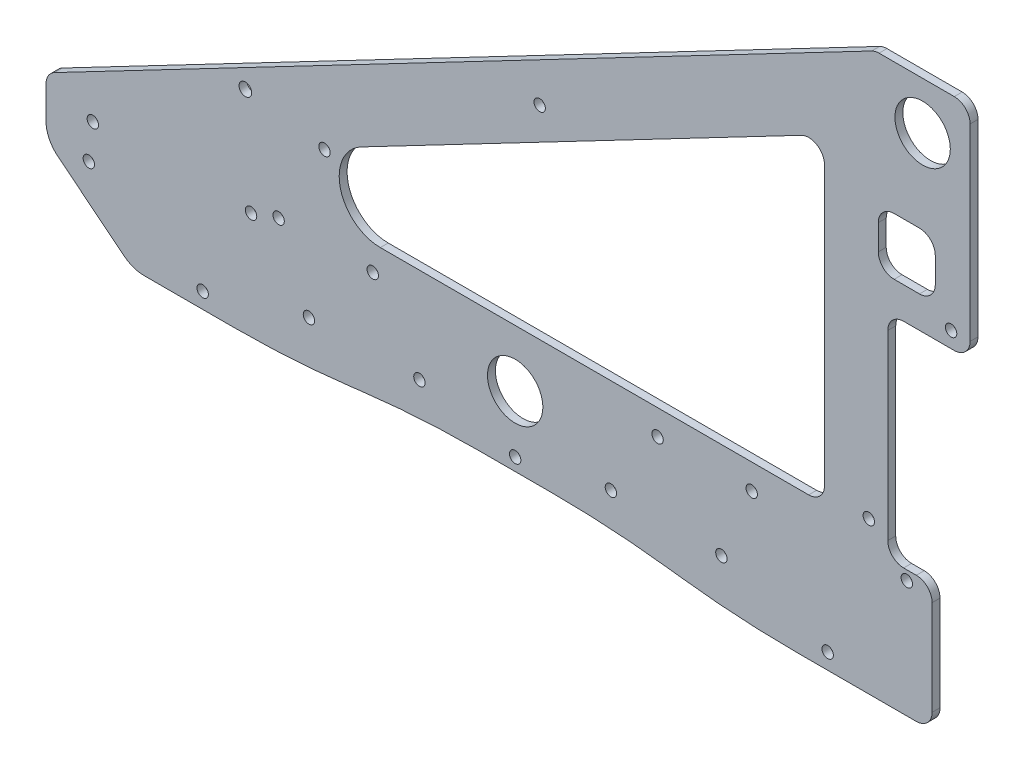
from build123d import *

# Parameters (mm, degrees)
SKETCH1_W            = 355.6
SKETCH1_H            = 50.8
SKETCH1_R            = 2.286
SKETCH1_R_2          = 11.1125
BOTTOM_2_DEPTH       = 3.175
CUT_EXTRUDE1_DEPTH   = 360.224276219
FILLET1_R            = 12.7
BOTTOM_CUTOUT_DEPTH  = 360.224276219
SKETCH5_R            = 11.1125
UPPER_TRIANGLE_DEPTH = 3.175
SKETCH6_R            = 2.286
GEARBOX_HOLES_DEPTH  = 421.704153444
SKETCH7_R            = 2.286
CUT_EXTRUDE4_DEPTH   = 421.704153444
SKETCH8_R            = 2.286
SKETCH8_W            = 22.86
SKETCH8_H            = 22.86
SKETCH8_W_2          = 33.02
SKETCH8_H_2          = 85.725
CUT_EXTRUDE5_DEPTH   = 421.704153444
SKETCH9_R            = 2.286
CUT_EXTRUDE6_DEPTH   = 421.704153444
FILLET2_R            = 6.35
FILLET3_R            = 6.35
SKETCH16_R           = 2.286
CUT_EXTRUDE12_DEPTH  = 421.704153444
FILLET11_R           = 16.51
SKETCH19_R           = 2.54
SKETCH19_R_2         = 2.286
CUT_EXTRUDE14_DEPTH  = 421.704153444
FILLET7_R            = 381
FILLET8_R            = 6.35
SKETCH12_R           = 2.286
CUT_EXTRUDE8_DEPTH   = 421.704153444


with BuildPart() as part:
    # Sketch1 → Bottom 2" (new body)
    with BuildSketch(Plane.XY):
        with Locations((-177.8, 25.4)):
            Rectangle(SKETCH1_W, SKETCH1_H)
        with Locations((-41.91, 6.35)):
            Circle(SKETCH1_R, mode=Mode.SUBTRACT)
        with Locations((-292.735, 6.35)):
            Circle(SKETCH1_R, mode=Mode.SUBTRACT)
        with Locations((-205.74, 19.05)):
            Circle(SKETCH1_R, mode=Mode.SUBTRACT)
        with Locations((-167.3225, 34.29)):
            Circle(SKETCH1_R_2, mode=Mode.SUBTRACT)
        with Locations((-250.085181934, 18.50662125)):
            Circle(SKETCH1_R, mode=Mode.SUBTRACT)
        with Locations((-84.559818066, 18.50662125)):
            Circle(SKETCH1_R, mode=Mode.SUBTRACT)
        with Locations((-128.905, 19.05)):
            Circle(SKETCH1_R, mode=Mode.SUBTRACT)
        with Locations((-338.41529526, 28.575)):
            Circle(SKETCH1_R, mode=Mode.SUBTRACT)
    extrude(amount=BOTTOM_2_DEPTH)

    # Sketch2 → Cut-Extrude1 (cut, through all)
    with BuildSketch(Plane.XY.offset(3.175)):
        Polygon((-384.175, 50.8), (-320.675, 0), (-384.175, 0), align=None)
    extrude(amount=-CUT_EXTRUDE1_DEPTH, mode=Mode.SUBTRACT)

    # Fillet1
    fillet1_edges = [part.edges().sort_by_distance(p)[0] for p in [
        (-355.6, 27.94, 1.5875),
        (-320.675, 0, 1.5875),
    ]]
    fillet(fillet1_edges, radius=FILLET1_R)

    # Sketch3 → Bottom Cutout (cut, through all)
    with BuildSketch(Plane.XY.offset(3.175)):
        Polygon((-256.54, 0), (-205.74, 6.35), (-128.905, 6.35), (-78.105, 0), align=None)
    extrude(amount=-BOTTOM_CUTOUT_DEPTH, mode=Mode.SUBTRACT)

    # Sketch5 → Upper Triangle (add)
    with BuildSketch(Plane.XY.offset(3.175)):
        Polygon((15.24, 50.8), (15.24, 224.79), (-22.86, 224.79), (-355.6, 50.8), align=None)
        with Locations((-3.81, 205.74)):
            Circle(SKETCH5_R, mode=Mode.SUBTRACT)
    extrude(amount=-UPPER_TRIANGLE_DEPTH)

    # Sketch6 → Gearbox Holes (cut, through all)
    with BuildSketch(Plane.XY.offset(3.175)):
        with Locations((-110.1725, 46.99)):
            Circle(SKETCH6_R)
        with Locations((-167.3225, 11.43)):
            Circle(SKETCH6_R)
        with Locations((-224.4725, 46.99)):
            Circle(SKETCH6_R)
    extrude(amount=-GEARBOX_HOLES_DEPTH, mode=Mode.SUBTRACT)

    # Sketch7 → Cut-Extrude4 (cut, through all)
    with BuildSketch(Plane.XY.offset(3.175)):
        with Locations((-25.4, 60.96)):
            Circle(SKETCH7_R)
    extrude(amount=-CUT_EXTRUDE4_DEPTH, mode=Mode.SUBTRACT)

    # Sketch8 → Cut-Extrude5 (cut, through all)
    with BuildSketch(Plane.XY.offset(3.175)):
        with Locations((7.62, 142.875)):
            Circle(SKETCH8_R)
        with Locations((-157.48, 138.632493002)):
            Circle(SKETCH8_R)
        with Locations((-10.16, 160.655)):
            Rectangle(SKETCH8_W, SKETCH8_H)
        with Locations((-1.27, 93.6625)):
            Rectangle(SKETCH8_W_2, SKETCH8_H_2)
        Polygon((-43.18, 185.501736062), (-43.18, 57.15), (-288.640984293, 57.15), align=None)
    extrude(amount=-CUT_EXTRUDE5_DEPTH, mode=Mode.SUBTRACT)

    # Sketch9 → Cut-Extrude6 (cut, through all)
    with BuildSketch(Plane(origin=(0, 0, 0), x_dir=(-1, 0, 0), z_dir=(0, 0, -1))):
        with Locations((10.16, 46.99)):
            Circle(SKETCH9_R)
        with Locations((72.39, 46.99)):
            Circle(SKETCH9_R)
    extrude(amount=-CUT_EXTRUDE6_DEPTH, mode=Mode.SUBTRACT)

    # Fillet2
    fillet2_edges = [part.edges().sort_by_distance(p)[0] for p in [
        (-43.18, 185.501736062, 1.5875),
        (-43.18, 57.15, 1.5875),
        (15.24, 136.525, 1.5875),
        (-17.78, 136.525, 1.5875),
        (-355.6, 50.8, 1.5875),
        (15.24, 224.79, 1.5875),
        (-22.86, 224.79, 1.5875),
    ]]
    fillet(fillet2_edges, radius=FILLET2_R)

    # Fillet3
    fillet3_edges = [part.edges().sort_by_distance(p)[0] for p in [
        (1.27, 172.085, 1.5875),
        (1.27, 149.225, 1.5875),
        (-21.59, 149.225, 1.5875),
        (-21.59, 172.085, 1.5875),
    ]]
    fillet(fillet3_edges, radius=FILLET3_R)

    # Sketch16 → Cut-Extrude12 (cut, through all)
    with BuildSketch(Plane.XY.offset(3.175)):
        with Locations((-262.255, 46.99)):
            Circle(SKETCH16_R)
    extrude(amount=-CUT_EXTRUDE12_DEPTH, mode=Mode.SUBTRACT)

    # Fillet11
    fillet11_edges = [part.edges().sort_by_distance(p)[0] for p in [
        (-288.640984293, 57.15, 1.5875),
    ]]
    fillet(fillet11_edges, radius=FILLET11_R)

    # Sketch19 → Cut-Extrude14 (cut, through all)
    with BuildSketch(Plane.XY.offset(3.175)):
        with Locations((-275.59, 85.09)):
            Circle(SKETCH19_R)
        with Locations((-243.84, 80.01)):
            Circle(SKETCH19_R_2)
    extrude(amount=-CUT_EXTRUDE14_DEPTH, mode=Mode.SUBTRACT)

    # Fillet7
    fillet7_edges = [part.edges().sort_by_distance(p)[0] for p in [
        (-78.105, 0, 1.5875),
        (-256.54, 0, 1.5875),
        (-205.74, 6.35, 1.5875),
        (-128.905, 6.35, 1.5875),
    ]]
    fillet(fillet7_edges, radius=FILLET7_R)

    # Fillet8
    fillet8_edges = [part.edges().sort_by_distance(p)[0] for p in [
        (-17.78, 50.8, 1.5875),
        (0, 50.8, 1.5875),
        (0, 0, 1.5875),
    ]]
    fillet(fillet8_edges, radius=FILLET8_R)

    # Sketch12 → Cut-Extrude8 (cut, through all)
    with BuildSketch(Plane.XY.offset(3.175)):
        with Locations((-336.804, 43.18)):
            Circle(SKETCH12_R)
        with Locations((-273.304, 43.18)):
            Circle(SKETCH12_R)
    extrude(amount=-CUT_EXTRUDE8_DEPTH, mode=Mode.SUBTRACT)


solid = part.part
